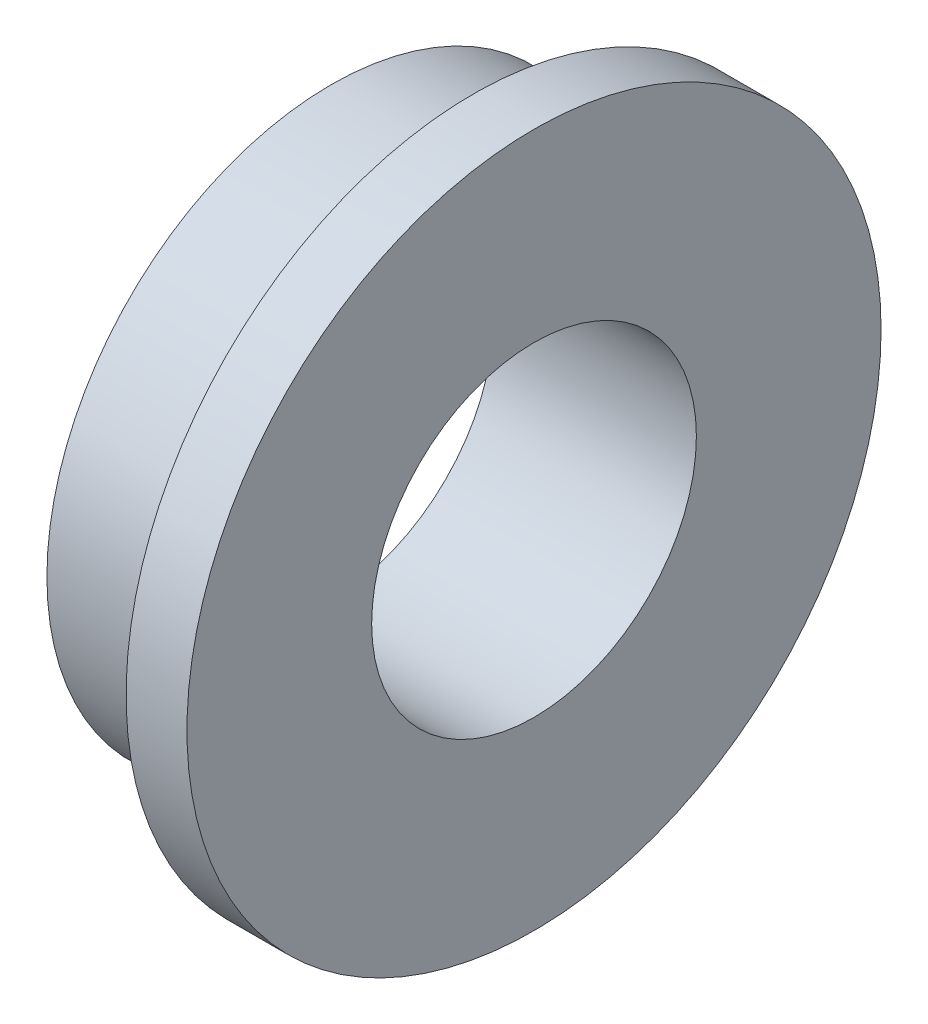
from build123d import *


with BuildPart() as part:
    # Croquis1 → Revolución1 (revolve)
    with BuildSketch(Plane(origin=(0, 0, 0), x_dir=(0, 1, 0), z_dir=(0, 0, 1)), mode=Mode.PRIVATE) as revoluci_n1_sk:
        Polygon((4, 0), (4, 5), (7, 5), (7, 1.5), (8.55, 1.5), (8.55, 0), align=None)
    revolve(revoluci_n1_sk.sketch.rotate(Axis((0, 0, 0), (-1, 0, 0)), 90), axis=Axis((0, 0, 0), (-1, 0, 0)))


solid = part.part
